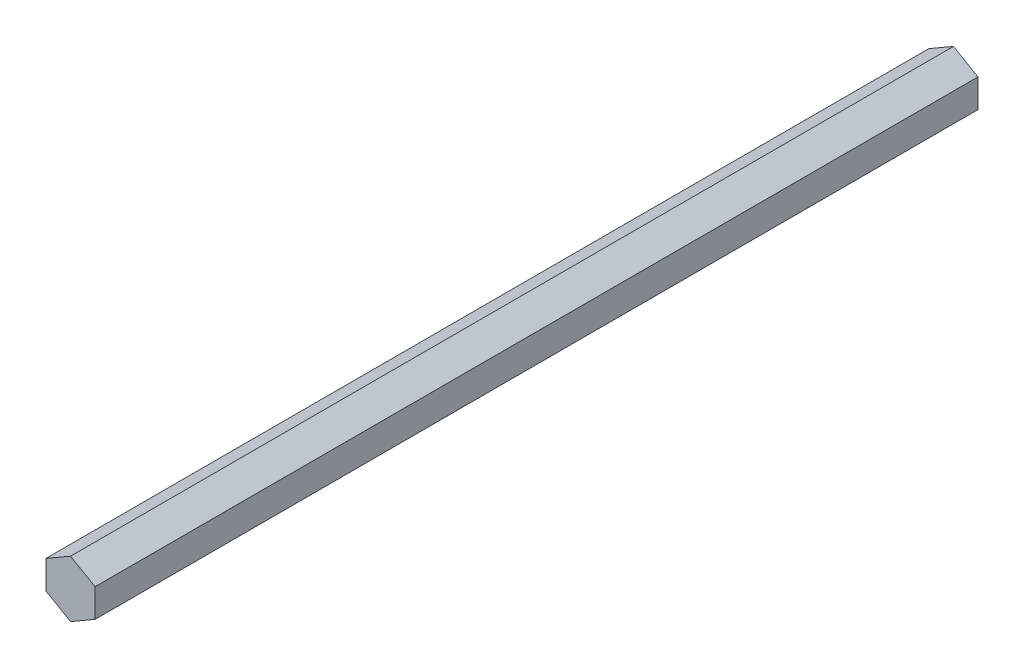
from build123d import *

# Parameters (mm, degrees)
BOSS_EXTRUDE1_DEPTH = 228.6


with BuildPart() as part:
    # Sketch1 → Boss-Extrude1 (new body)
    with BuildSketch(Plane.XY):
        Polygon((0, 7.332348419), (-6.35, 3.666174209), (-6.35, -3.666174209), (0, -7.332348419), (6.35, -3.666174209), (6.35, 3.666174209), align=None)
    extrude(amount=BOSS_EXTRUDE1_DEPTH)


solid = part.part
